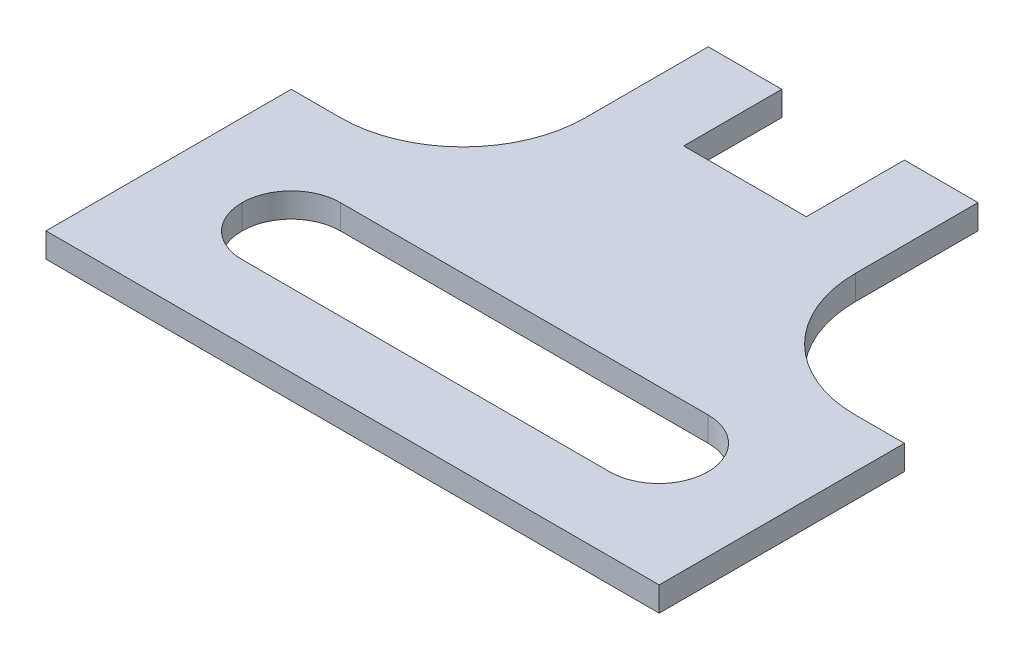
from build123d import *

# Parameters (mm, degrees)
BOSS_EXTRUDE1_DEPTH = 1


with BuildPart() as part:
    # Sketch1 → Boss-Extrude1 (new body)
    with BuildSketch(Plane(origin=(0, 0, 0), x_dir=(1, 0, 0), z_dir=(0, 1, 0))):
        with BuildLine():
            Line((-0.811022124, 5.668679597), (-0.811022124, 10.668679597))
            Line((-0.811022124, 10.668679597), (2.188977876, 10.668679597))
            Line((2.188977876, 10.668679597), (2.188977876, 6.668679597))
            Line((2.188977876, 6.668679597), (7.188977876, 6.668679597))
            Line((7.188977876, 6.668679597), (7.188977876, 10.668679597))
            Line((7.188977876, 10.668679597), (10.188977876, 10.668679597))
            Line((10.188977876, 10.668679597), (10.188977876, 5.668679597))
            ThreePointArc((10.188977876, 5.668679597), (11.65344397, 2.133145691), (15.188977876, 0.668679597))
            Line((15.188977876, 0.668679597), (17.188977876, 0.668679597))
            Line((17.188977876, 0.668679597), (17.188977876, -9.331320403))
            Line((17.188977876, -9.331320403), (-7.811022124, -9.331320403))
            Line((-7.811022124, -9.331320403), (-7.811022124, 0.668679597))
            Line((-7.811022124, 0.668679597), (-5.811022124, 0.668679597))
            ThreePointArc((-5.811022124, 0.668679597), (-2.275488218, 2.133145691), (-0.811022124, 5.668679597))
        make_face()
        with BuildLine():
            Line((-2.811022124, -2.331320403), (12.188977876, -2.331320403))
            ThreePointArc((12.188977876, -2.331320403), (13.603191438, -2.917106841), (14.188977876, -4.331320403))
            Line((14.188977876, -4.331320403), (14.188977876, -4.346932121))
            ThreePointArc((14.188977876, -4.346932121), (13.603191438, -5.761145684), (12.188977876, -6.346932121))
            Line((12.188977876, -6.346932121), (-2.811022124, -6.346932121))
            ThreePointArc((-2.811022124, -6.346932121), (-4.225235686, -5.761145684), (-4.811022124, -4.346932121))
            Line((-4.811022124, -4.346932121), (-4.811022124, -4.331320403))
            ThreePointArc((-4.811022124, -4.331320403), (-4.225235686, -2.917106841), (-2.811022124, -2.331320403))
        make_face(mode=Mode.SUBTRACT)
    extrude(amount=BOSS_EXTRUDE1_DEPTH)


solid = part.part
